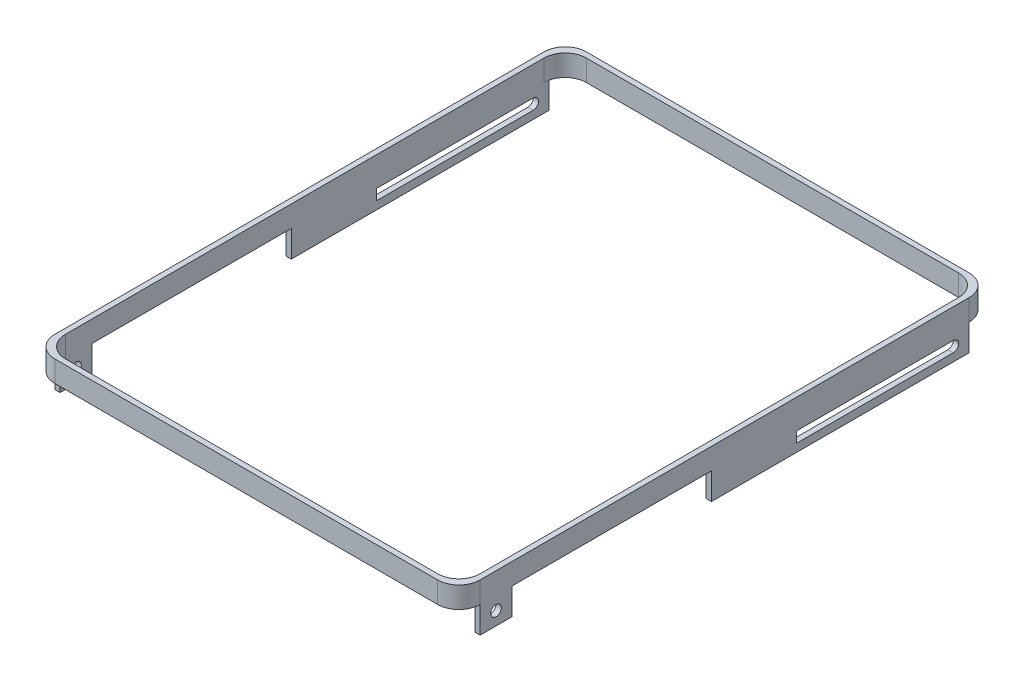
from build123d import *

# Parameters (mm, degrees)
BOSS_EXTRUDE2_DEPTH     = 20
CUT_EXTRUDE1_DEPTH      = 20
SKETCH7_W               = 242.556539121
SKETCH7_H               = 25
BOSS_EXTRUDE3_DEPTH     = 5
SKETCH8_W               = 242.556539121
SKETCH8_H               = 25
BOSS_EXTRUDE4_DEPTH     = 5
CUT_EXTRUDE2_DEPTH      = 473.361090692
CUT_EXTRUDE2_DEPTH_BACK = 473.361090692
SKETCH11_W              = 30
SKETCH11_H              = 25
BOSS_EXTRUDE5_DEPTH     = 5
SKETCH13_W              = 30
SKETCH13_H              = 25
BOSS_EXTRUDE6_DEPTH     = 5
SKETCH14_R              = 5
CUT_EXTRUDE3_DEPTH      = 473.361090692
BOSS_EXTRUDE7_DEPTH     = 5
BOSS_EXTRUDE8_START     = -5
BOSS_EXTRUDE8_DEPTH     = 5


with BuildPart() as part:
    # Sketch5 → Boss-Extrude2 (new body)
    with BuildSketch(Plane(origin=(0, 0, 0), x_dir=(1, 0, 0), z_dir=(0, 1, 0))):
        with BuildLine():
            Line((-180, 250), (180, 250))
            ThreePointArc((180, 250), (194.142135624, 244.142135624), (200, 230))
            Line((200, 230), (200, -230))
            ThreePointArc((200, -230), (194.142135624, -244.142135624), (180, -250))
            Line((180, -250), (-180, -250))
            ThreePointArc((-180, -250), (-194.142135624, -244.142135624), (-200, -230))
            Line((-200, -230), (-200, 230))
            ThreePointArc((-200, 230), (-194.142135624, 244.142135624), (-180, 250))
        make_face()
    extrude(amount=BOSS_EXTRUDE2_DEPTH)

    # Sketch6 → Cut-Extrude1 (cut)
    with BuildSketch(Plane(origin=(0, 20, 0), x_dir=(1, 0, 0), z_dir=(0, 1, 0))):
        with BuildLine():
            Line((-175, -245), (175, -245))
            ThreePointArc((175, -245), (189.142135624, -239.142135624), (195, -225))
            Line((195, -225), (195, 225))
            ThreePointArc((195, 225), (189.142135624, 239.142135624), (175, 245))
            Line((175, 245), (-175, 245))
            ThreePointArc((-175, 245), (-189.142135624, 239.142135624), (-195, 225))
            Line((-195, 225), (-195, -225))
            ThreePointArc((-195, -225), (-189.142135624, -239.142135624), (-175, -245))
        make_face()
    extrude(amount=-CUT_EXTRUDE1_DEPTH, mode=Mode.SUBTRACT)

    # Sketch7 → Boss-Extrude3 (add)
    with BuildSketch(Plane(origin=(200, 0, 0), x_dir=(0, 0, -1), z_dir=(1, 0, 0))):
        with Locations((108.72173044, -12.5)):
            Rectangle(SKETCH7_W, SKETCH7_H)
    extrude(amount=-BOSS_EXTRUDE3_DEPTH)

    # Sketch8 → Boss-Extrude4 (add)
    with BuildSketch(Plane.ZY.offset(200)):
        with Locations((-108.72173044, -12.5)):
            Rectangle(SKETCH8_W, SKETCH8_H)
    extrude(amount=-BOSS_EXTRUDE4_DEPTH)

    # Sketch10 → Cut-Extrude2 (cut, two sides: drawn at the far end of the back side and taken through both)
    with BuildSketch(Plane(origin=(200, 0, 0), x_dir=(0, 0, -1), z_dir=(1, 0, 0)).offset(-CUT_EXTRUDE2_DEPTH_BACK)):
        with BuildLine():
            Line((214.975112076, -7.5), (2.443460879, -7.5))
            ThreePointArc((2.443460879, -7.5), (-2.556539121, -12.5), (2.443460879, -17.5))
            Line((2.443460879, -17.5), (214.975112076, -17.5))
            ThreePointArc((214.975112076, -17.5), (219.975112076, -12.5), (214.975112076, -7.5))
        make_face()
    extrude(amount=CUT_EXTRUDE2_DEPTH + CUT_EXTRUDE2_DEPTH_BACK, mode=Mode.SUBTRACT)

    # Sketch11 → Boss-Extrude5 (add)
    with BuildSketch(Plane(origin=(200, 0, 0), x_dir=(0, 0, -1), z_dir=(1, 0, 0))):
        with Locations((-215, -12.5)):
            Rectangle(SKETCH11_W, SKETCH11_H)
    extrude(amount=-BOSS_EXTRUDE5_DEPTH)

    # Sketch13 → Boss-Extrude6 (add)
    with BuildSketch(Plane.ZY.offset(200)):
        with Locations((215, -12.5)):
            Rectangle(SKETCH13_W, SKETCH13_H)
    extrude(amount=-BOSS_EXTRUDE6_DEPTH)

    # Sketch14 → Cut-Extrude3 (cut, through all)
    with BuildSketch(Plane.ZY.offset(200)):
        with Locations((215, -12.5)):
            Circle(SKETCH14_R)
    extrude(amount=-CUT_EXTRUDE3_DEPTH, mode=Mode.SUBTRACT)

    # Sketch16 → Boss-Extrude7 (add)
    with BuildSketch(Plane.ZY.offset(200)):
        with BuildLine():
            Line((-67.443460879, -17.5), (-2.443460879, -17.5))
            ThreePointArc((-2.443460879, -17.5), (2.556539121, -12.5), (-2.443460879, -7.5))
            Line((-2.443460879, -7.5), (-67.443460879, -7.5))
            Line((-67.443460879, -7.5), (-67.443460879, -17.5))
        make_face()
    extrude(amount=-BOSS_EXTRUDE7_DEPTH)

    # Sketch17 → Boss-Extrude8 (add)
    with BuildSketch(Plane(origin=(200, 0, 0), x_dir=(0, 0, -1), z_dir=(1, 0, 0)).offset(BOSS_EXTRUDE8_START)):
        with BuildLine():
            Line((67.443460879, -17.5), (67.443460879, -7.5))
            Line((67.443460879, -7.5), (2.443460879, -7.5))
            ThreePointArc((2.443460879, -7.5), (-2.556539121, -12.5), (2.443460879, -17.5))
            Line((2.443460879, -17.5), (67.443460879, -17.5))
        make_face()
    extrude(amount=BOSS_EXTRUDE8_DEPTH)


solid = part.part
